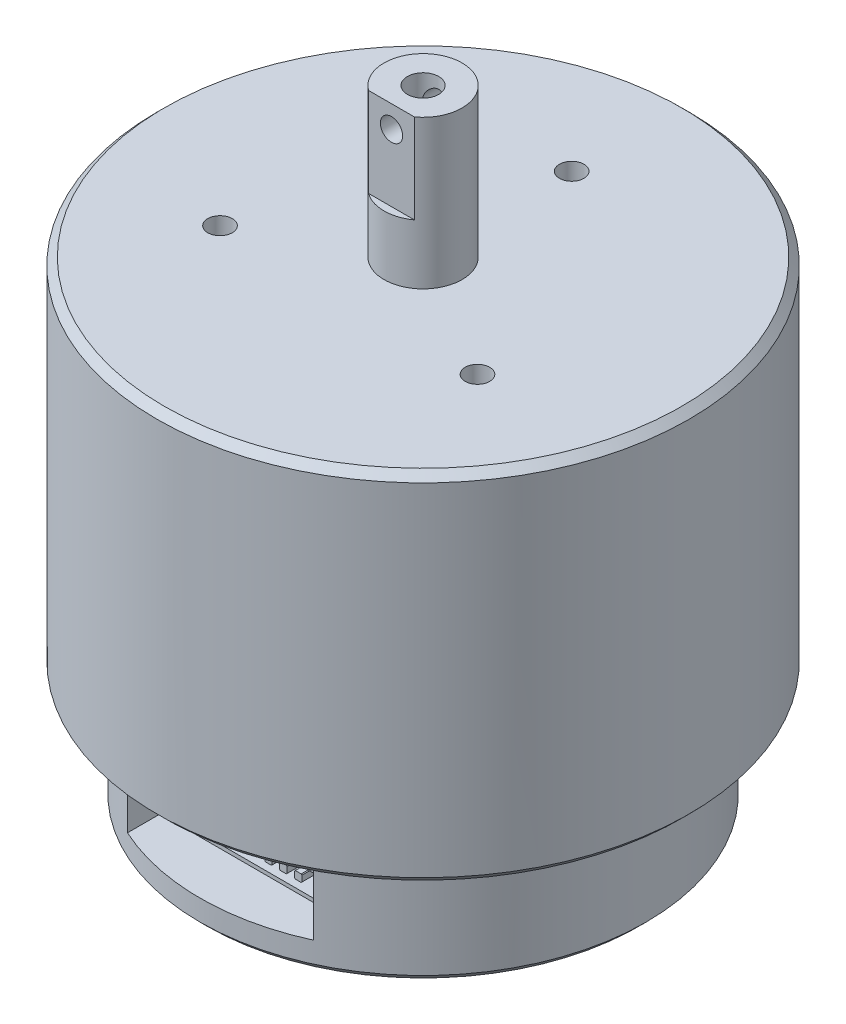
from build123d import *

# Parameters (mm, degrees)
HOLE_WIZARD_M5_1_D       = 4.2
HOLE_WIZARD_M5_1_DEPTH   = 12.4
HOLE_WIZARD_M5_1_TIP     = 1.2618073
CUT_EXTRUDE_1_DEPTH      = 12
SKETCH_4_R               = 1.5
CUT_EXTRUDE_2_DEPTH      = 12
SKETCH_5_W               = 25
SKETCH_5_H               = 11.7
CUT_EXTRUDE_3_DEPTH      = 17
SKETCH_6_W               = 20
SKETCH_6_H               = 4
SKETCH_6_W_2             = 19
SKETCH_6_H_2             = 3
EXTRUDE_1_DEPTH          = 5
SKETCH_7_W               = 25
SKETCH_7_H               = 1
EXTRUDE_2_DEPTH          = 6
PATTERN_CIRCULAR_1_COUNT = 3
CHAMFER_1_SIZE           = 1
CHAMFER_2_SIZE           = 1


with BuildPart() as part:
    # 草图1 → 旋转1 (revolve)
    with BuildSketch(Plane.XY, mode=Mode.PRIVATE) as revolve_1_sk:
        Polygon((0, 86.697277349), (5.25, 86.697277349), (5.25, 66.697277349), (35.8, 66.697277349), (35.8, 18.697277349), (30, 18.697277349), (30, 3.197277349), (0, 3.197277349), align=None)
    revolve(revolve_1_sk.sketch.rotate(Axis((0, 0, 0), (0, 1, 0)), 90), axis=Axis((0, 0, 0), (0, 1, 0)))

    # M5 螺纹孔1
    with Locations(Plane.ZX.offset(86.697277349)):
        with Locations((0, 0)):
            Hole(HOLE_WIZARD_M5_1_D / 2, depth=HOLE_WIZARD_M5_1_DEPTH)
            with Locations((0, 0, -(HOLE_WIZARD_M5_1_DEPTH + HOLE_WIZARD_M5_1_TIP / 2))):  # 118° drill point
                Cone(0, HOLE_WIZARD_M5_1_D / 2, HOLE_WIZARD_M5_1_TIP, mode=Mode.SUBTRACT)

    # 草图3 → 切除-拉伸1 (cut)
    with BuildSketch(Plane(origin=(0, 86.697277349, 0), x_dir=(1, 0, 0), z_dir=(0, 1, 0))):
        Polygon((-3.082207001, -4.25), (3.082207001, -4.25), (3.082207001, -5.665214362), (-3.082207001, -5.459608107), align=None)
    extrude(amount=-CUT_EXTRUDE_1_DEPTH, mode=Mode.SUBTRACT)

    # 草图4 → 切除-拉伸2 (cut)
    with BuildSketch(Plane.XY.offset(4.25)):
        with Locations((0, 83.697277349)):
            Circle(SKETCH_4_R)
    extrude(amount=-CUT_EXTRUDE_2_DEPTH, mode=Mode.SUBTRACT)

    # 草图5 → 切除-拉伸3 (cut)
    with BuildSketch(Plane.XY.offset(35.8)):
        with Locations((0, 12.847277349)):
            Rectangle(SKETCH_5_W, SKETCH_5_H)
    extrude(amount=-CUT_EXTRUDE_3_DEPTH, mode=Mode.SUBTRACT)

    # 草图6 → 凸台-拉伸1 (add)
    # profile 1 of 18: a face of its own
    with BuildSketch(Plane.XY.offset(18.8)):
        with Locations((0, 9.922277349)):
            Rectangle(SKETCH_6_W, SKETCH_6_H)
        with Locations((0, 9.922277349)):
            Rectangle(SKETCH_6_W_2, SKETCH_6_H_2, mode=Mode.SUBTRACT)
    # profile 2 of 18: a face of its own
    with BuildSketch(Plane.XY.offset(18.8)):
        Polygon((-6.5, 10.322277349), (-6.6, 10.422277349), (-7.4, 10.422277349), (-7.5, 10.322277349), (-7.5, 9.522277349), (-7.4, 9.422277349), (-6.6, 9.422277349), (-6.5, 9.522277349), align=None)
    # profile 3 of 18: a face of its own
    with BuildSketch(Plane.XY.offset(18.8)):
        Polygon((-4.5, 10.322277349), (-4.6, 10.422277349), (-5.4, 10.422277349), (-5.5, 10.322277349), (-5.5, 9.522277349), (-5.4, 9.422277349), (-4.6, 9.422277349), (-4.5, 9.522277349), align=None)
    # profile 4 of 18: a face of its own
    with BuildSketch(Plane.XY.offset(18.8)):
        Polygon((-2.5, 10.322277349), (-2.6, 10.422277349), (-3.4, 10.422277349), (-3.5, 10.322277349), (-3.5, 9.522277349), (-3.4, 9.422277349), (-2.6, 9.422277349), (-2.5, 9.522277349), align=None)
    # profile 5 of 18: a face of its own
    with BuildSketch(Plane.XY.offset(18.8)):
        Polygon((-0.5, 10.322277349), (-0.5, 9.522277349), (-0.6, 9.422277349), (-1.4, 9.422277349), (-1.5, 9.522277349), (-1.5, 10.322277349), (-1.4, 10.422277349), (-0.6, 10.422277349), align=None)
    # profile 6 of 18: a face of its own
    with BuildSketch(Plane.XY.offset(18.8)):
        Polygon((1.4, 10.422277349), (1.5, 10.322277349), (1.5, 9.522277349), (1.4, 9.422277349), (0.6, 9.422277349), (0.5, 9.522277349), (0.5, 10.322277349), (0.6, 10.422277349), align=None)
    # profile 7 of 18: a face of its own
    with BuildSketch(Plane.XY.offset(18.8)):
        Polygon((3.4, 10.422277349), (3.5, 10.322277349), (3.5, 9.522277349), (3.4, 9.422277349), (2.6, 9.422277349), (2.5, 9.522277349), (2.5, 10.322277349), (2.6, 10.422277349), align=None)
    # profile 8 of 18: a face of its own
    with BuildSketch(Plane.XY.offset(18.8)):
        Polygon((5.4, 10.422277349), (5.5, 10.322277349), (5.5, 9.522277349), (5.4, 9.422277349), (4.6, 9.422277349), (4.5, 9.522277349), (4.5, 10.322277349), (4.6, 10.422277349), align=None)
    # profile 9 of 18: a face of its own
    with BuildSketch(Plane.XY.offset(18.8)):
        Polygon((7.4, 10.422277349), (7.5, 10.322277349), (7.5, 9.522277349), (7.4, 9.422277349), (6.6, 9.422277349), (6.5, 9.522277349), (6.5, 10.322277349), (6.6, 10.422277349), align=None)
    # profile 10 of 18: a face of its own
    with BuildSketch(Plane.XY.offset(18.8)):
        with Locations((0, 15.772277349)):
            Rectangle(SKETCH_6_W, SKETCH_6_H)
        with Locations((0, 15.772277349)):
            Rectangle(SKETCH_6_W_2, SKETCH_6_H_2, mode=Mode.SUBTRACT)
    # profile 11 of 18: a face of its own
    with BuildSketch(Plane.XY.offset(18.8)):
        Polygon((6.5, 15.372277349), (6.6, 15.272277349), (7.4, 15.272277349), (7.5, 15.372277349), (7.5, 16.172277349), (7.4, 16.272277349), (6.6, 16.272277349), (6.5, 16.172277349), align=None)
    # profile 12 of 18: a face of its own
    with BuildSketch(Plane.XY.offset(18.8)):
        Polygon((4.5, 15.372277349), (4.6, 15.272277349), (5.4, 15.272277349), (5.5, 15.372277349), (5.5, 16.172277349), (5.4, 16.272277349), (4.6, 16.272277349), (4.5, 16.172277349), align=None)
    # profile 13 of 18: a face of its own
    with BuildSketch(Plane.XY.offset(18.8)):
        Polygon((2.5, 15.372277349), (2.6, 15.272277349), (3.4, 15.272277349), (3.5, 15.372277349), (3.5, 16.172277349), (3.4, 16.272277349), (2.6, 16.272277349), (2.5, 16.172277349), align=None)
    # profile 14 of 18: a face of its own
    with BuildSketch(Plane.XY.offset(18.8)):
        Polygon((0.5, 15.372277349), (0.5, 16.172277349), (0.6, 16.272277349), (1.4, 16.272277349), (1.5, 16.172277349), (1.5, 15.372277349), (1.4, 15.272277349), (0.6, 15.272277349), align=None)
    # profile 15 of 18: a face of its own
    with BuildSketch(Plane.XY.offset(18.8)):
        Polygon((-1.4, 15.272277349), (-1.5, 15.372277349), (-1.5, 16.172277349), (-1.4, 16.272277349), (-0.6, 16.272277349), (-0.5, 16.172277349), (-0.5, 15.372277349), (-0.6, 15.272277349), align=None)
    # profile 16 of 18: a face of its own
    with BuildSketch(Plane.XY.offset(18.8)):
        Polygon((-3.4, 15.272277349), (-3.5, 15.372277349), (-3.5, 16.172277349), (-3.4, 16.272277349), (-2.6, 16.272277349), (-2.5, 16.172277349), (-2.5, 15.372277349), (-2.6, 15.272277349), align=None)
    # profile 17 of 18: a face of its own
    with BuildSketch(Plane.XY.offset(18.8)):
        Polygon((-5.4, 15.272277349), (-5.5, 15.372277349), (-5.5, 16.172277349), (-5.4, 16.272277349), (-4.6, 16.272277349), (-4.5, 16.172277349), (-4.5, 15.372277349), (-4.6, 15.272277349), align=None)
    # profile 18 of 18: a face of its own
    with BuildSketch(Plane.XY.offset(18.8)):
        Polygon((-7.4, 15.272277349), (-7.5, 15.372277349), (-7.5, 16.172277349), (-7.4, 16.272277349), (-6.6, 16.272277349), (-6.5, 16.172277349), (-6.5, 15.372277349), (-6.6, 15.272277349), align=None)
    extrude(amount=EXTRUDE_1_DEPTH)

    # 草图7 → 凸台-拉伸2 (add)
    with BuildSketch(Plane.XY.offset(18.8)):
        with Locations((0, 12.849583466)):
            Rectangle(SKETCH_7_W, SKETCH_7_H)
    extrude(amount=EXTRUDE_2_DEPTH)

    # 草图9 → M4 螺纹孔1 (revolve, cut)
    with BuildSketch(Plane(origin=(0, 66.697277349, -20), x_dir=(0, 0, 1), z_dir=(1, 0, 0))):
        Polygon((0, 0), (0, 8.091420021), (1.65, 7.1), (1.65, 0), align=None)
    hole_wizard_m4_1 = revolve(axis=Axis((0, 73.047277349, -20), (0, -1, 0)), mode=Mode.SUBTRACT)

    # 阵列(圆周)1: M4 螺纹孔1 ×3 about axis
    pattern_circular_1_axis = Axis((0, 0, 0), (0, 1, 0))
    for i in range(1, PATTERN_CIRCULAR_1_COUNT):
        add(hole_wizard_m4_1.rotate(pattern_circular_1_axis, i * 360 / PATTERN_CIRCULAR_1_COUNT), mode=Mode.SUBTRACT)

    # 倒角1
    chamfer_1_edges = [part.edges().sort_by_distance(p)[0] for p in [
        (0, 18.697277349, 35.8),
        (0, 66.697277349, 35.8),
    ]]
    chamfer(chamfer_1_edges, length=CHAMFER_1_SIZE)

    # 倒角2
    chamfer_2_edges = [part.edges().sort_by_distance(p)[0] for p in [
        (0, 3.197277349, 30),
    ]]
    chamfer(chamfer_2_edges, length=CHAMFER_2_SIZE)


solid = part.part
